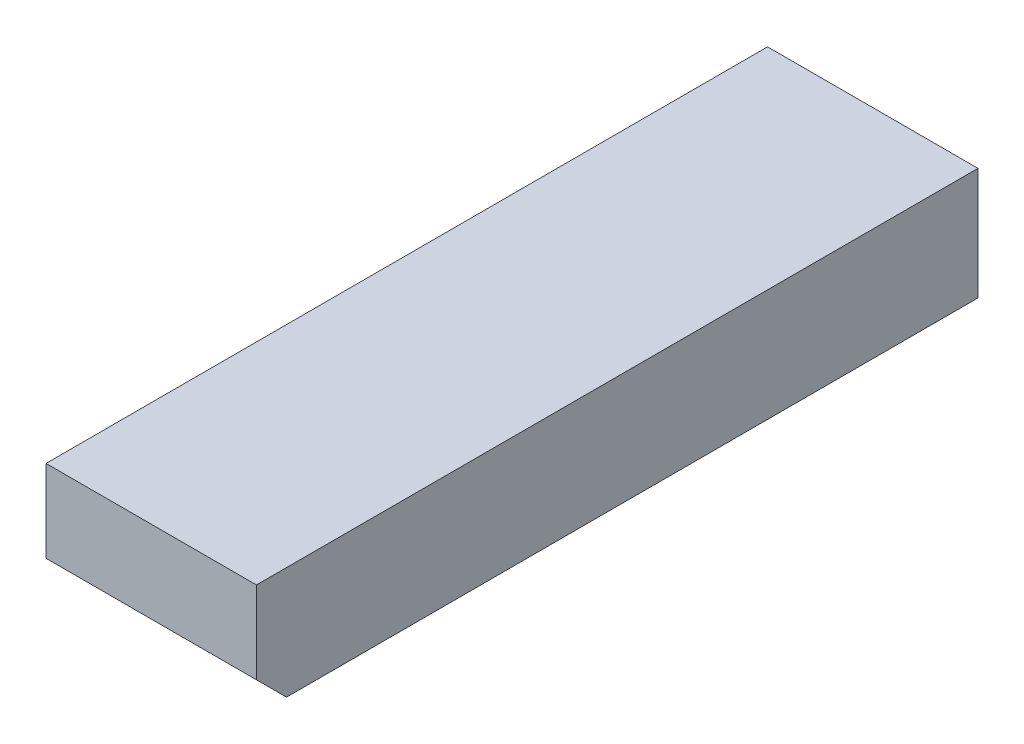
from build123d import *

# Parameters (mm, degrees)
SKETCH1_W           = 26.67
SKETCH1_H           = 14.224
BOSS_EXTRUDE1_DEPTH = 91.44
CHAMFER1_SIZE       = 3.81


with BuildPart() as part:
    # Sketch1 → Boss-Extrude1 (new body)
    with BuildSketch(Plane.XY):
        with Locations((13.335, 7.112)):
            Rectangle(SKETCH1_W, SKETCH1_H)
    extrude(amount=BOSS_EXTRUDE1_DEPTH)

    # Chamfer1
    chamfer1_edges = [part.edges().sort_by_distance(p)[0] for p in [
        (13.335, 0, 91.44),
    ]]
    chamfer(chamfer1_edges, length=CHAMFER1_SIZE)


solid = part.part
